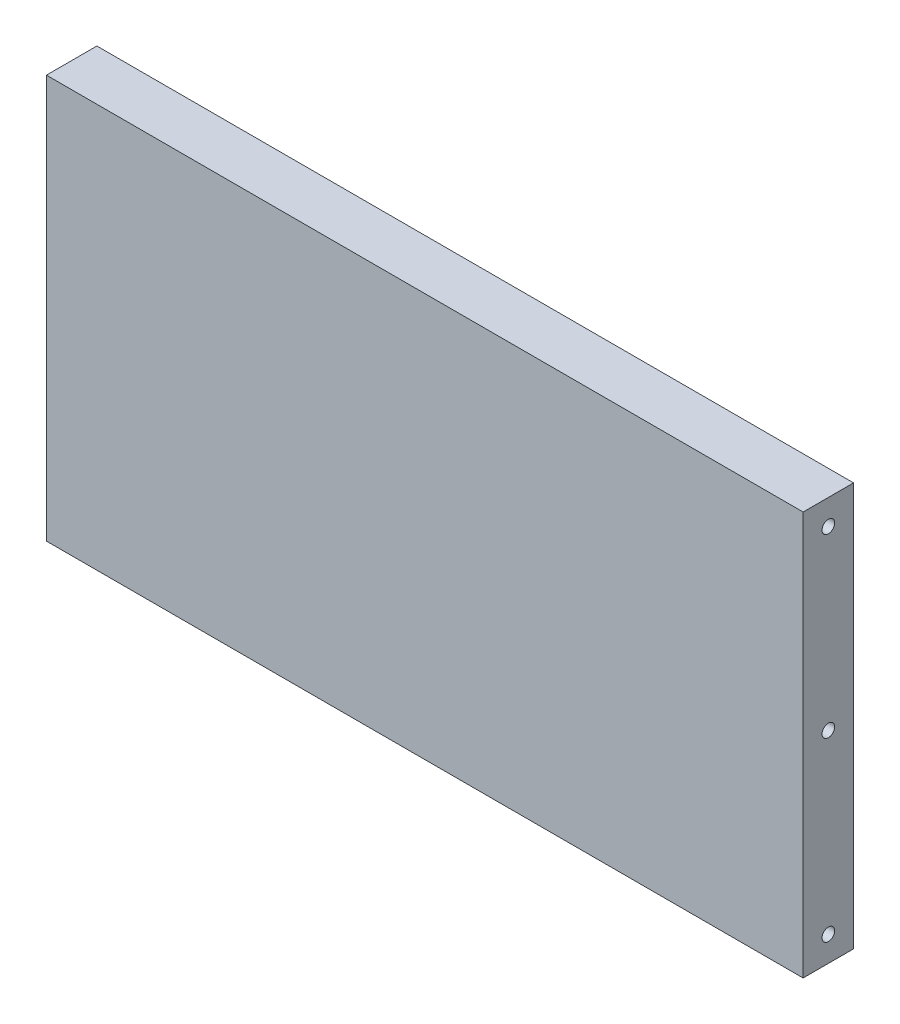
from build123d import *

# Parameters (mm, degrees)
SKIZZE1_W                       = 150
SKIZZE1_H                       = 80
AUFSATZ_LINEAR_AUSTRAGEN1_DEPTH = 10
SKIZZE2_R                       = 1.25
SCHNITT_LINEAR_AUSTRAGEN1_DEPTH = 5
SCHNITT_LINEAR_START            = -5
SKIZZE3_R                       = 1.25
SCHNITT_LINEAR_AUSTRAGEN2_DEPTH = 5


with BuildPart() as part:
    # Skizze1 → Aufsatz-Linear austragen1 (new body)
    with BuildSketch(Plane.XY):
        with Locations((9.444388014, 25.227272727)):
            Rectangle(SKIZZE1_W, SKIZZE1_H)
    extrude(amount=AUFSATZ_LINEAR_AUSTRAGEN1_DEPTH)

    # Skizze2 → Schnitt-Linear austragen1 (cut)
    with BuildSketch(Plane.ZY.offset(65.555611986)):
        with Locations(Location((5, 60.227272727, 0), (0, 0, 270))):
            Circle(SKIZZE2_R)
        with Locations(Location((5, 25.227272727, 0), (0, 0, 270))):
            Circle(SKIZZE2_R)
        with Locations(Location((5, -9.772727273, 0), (0, 0, 270))):
            Circle(SKIZZE2_R)
    extrude(amount=-SCHNITT_LINEAR_AUSTRAGEN1_DEPTH, mode=Mode.SUBTRACT)

    # Skizze3 → Schnitt-Linear austragen2 (cut)
    with BuildSketch(Plane(origin=(84.444388014, 0, 0), x_dir=(0, 0, -1), z_dir=(1, 0, 0)).offset(SCHNITT_LINEAR_START)):
        with Locations(Location((-5, 60.227272727, 0), (0, 0, 270))):
            Circle(SKIZZE3_R)
        with Locations(Location((-5, 25.227272727, 0), (0, 0, 270))):
            Circle(SKIZZE3_R)
        with Locations(Location((-5, -9.772727273, 0), (0, 0, 270))):
            Circle(SKIZZE3_R)
    extrude(amount=SCHNITT_LINEAR_AUSTRAGEN2_DEPTH, mode=Mode.SUBTRACT)


solid = part.part
